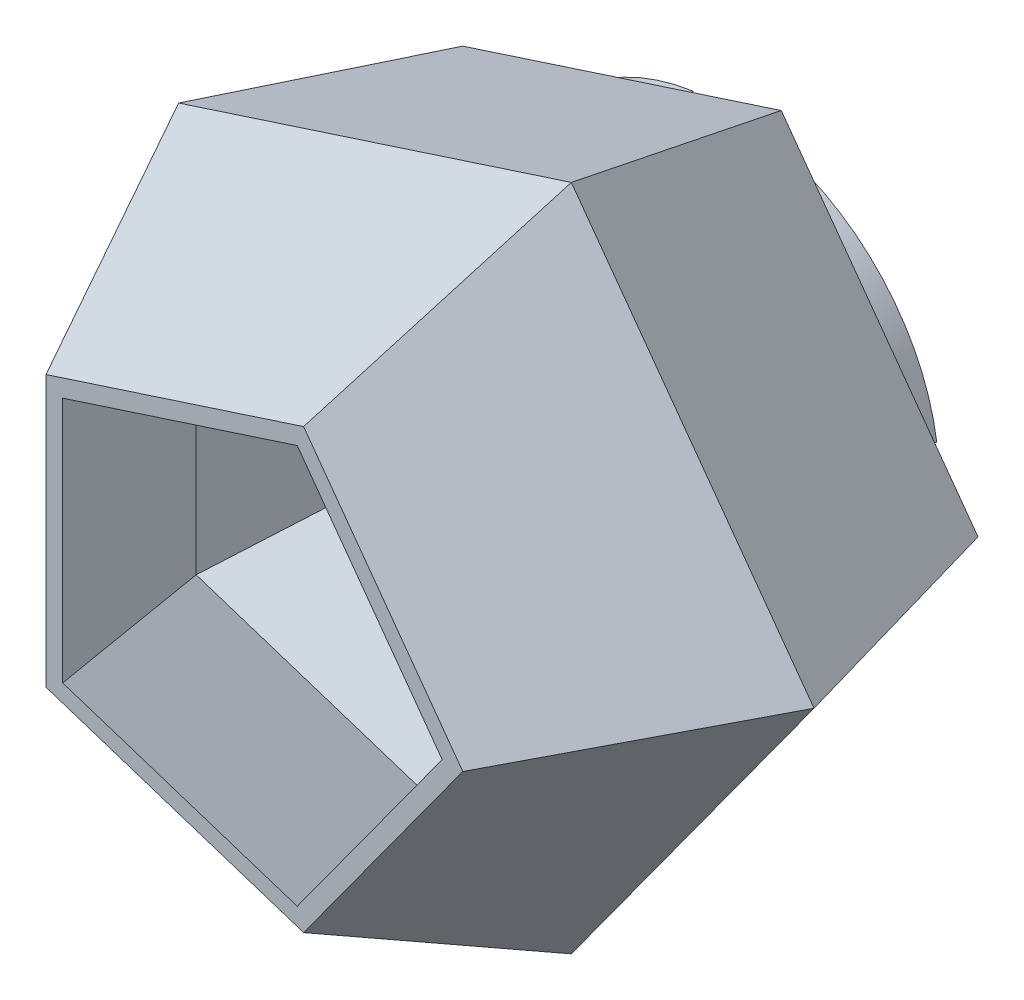
from build123d import *

# Parameters (mm, degrees)
VACIADO1_T              = -1
CROQUIS6_R              = 2.480361355
CORTAR_EXTRUIR1_DEPTH   = 10
SALIENTE_EXTRUIR1_DEPTH = 2


with BuildPart() as part:
    # Croquis2 → Recubrir1 section 0
    with BuildSketch(Plane.XY):
        with BuildLine():
            Line((18.541019662, 0), (5.729490169, 17.633557569))
            Line((5.729490169, 17.633557569), (-15, 10.89813792))
            Line((-15, 10.89813792), (-15, -10.89813792))
            Line((-15, -10.89813792), (5.729490169, -17.633557569))
            Line((5.729490169, -17.633557569), (18.541019662, 0))
        make_face()
    # Croquis3 → Recubrir1 section 1
    with BuildSketch(Plane.XY.offset(15)):
        with BuildLine():
            Line((22.867257584, 0), (7.066371208, 21.748054335))
            Line((7.066371208, 21.748054335), (-18.5, 13.441036768))
            Line((-18.5, 13.441036768), (-18.5, -13.441036768))
            Line((-18.5, -13.441036768), (7.066371208, -21.748054335))
            Line((7.066371208, -21.748054335), (22.867257584, 0))
        make_face()
    loft()

    # Croquis4 → section 1 of recubrir2
    with BuildSketch(Plane.XY.offset(30), mode=Mode.PRIVATE) as recubrir2_s1:
        with BuildLine():
            Line((15, 0), (4.635254916, 14.265847744))
            Line((4.635254916, 14.265847744), (-12.135254916, 8.816778784))
            Line((-12.135254916, 8.816778784), (-12.135254916, -8.816778784))
            Line((-12.135254916, -8.816778784), (4.635254916, -14.265847744))
            Line((4.635254916, -14.265847744), (15, 0))
        make_face()
    # loft from a face of the part (recubrir2)
    loft([part.faces().sort_by_distance((0, 0, 15))[0], recubrir2_s1.sketch])

    # Vaciado1
    vaciado1_openings = [part.faces().sort_by_distance(p)[0] for p in [
        (0, 0, 30),
    ]]
    offset(amount=VACIADO1_T, openings=vaciado1_openings, kind=Kind.INTERSECTION)

    # Croquis6 → Cortar-Extruir1 (cut)
    with BuildSketch(Plane(origin=(0, 0, 0), x_dir=(-1, 0, 0), z_dir=(0, 0, -1))):
        Circle(CROQUIS6_R)
    extrude(amount=-CORTAR_EXTRUIR1_DEPTH, mode=Mode.SUBTRACT)

    # Croquis7 → Saliente-Extruir1 (add)
    with BuildSketch(Plane(origin=(0, 0, 0), x_dir=(-1, 0, 0), z_dir=(0, 0, -1))):
        with BuildLine():
            Line((-2, 13.856406461), (-2, 11.324751653))
            ThreePointArc((-2, 11.324751653), (-8.131727984, 8.131727984), (-11.324751653, 2))
            Line((-11.324751653, 2), (-13.856406461, 2))
            ThreePointArc((-13.856406461, 2), (-9.899494937, 9.899494937), (-2, 13.856406461))
        make_face()
        with BuildLine():
            Line((2, 13.856406461), (2, 11.324751653))
            ThreePointArc((2, 11.324751653), (8.131727984, 8.131727984), (11.324751653, 2))
            Line((11.324751653, 2), (13.856406461, 2))
            ThreePointArc((13.856406461, 2), (9.899494937, 9.899494937), (2, 13.856406461))
        make_face()
        with BuildLine():
            Line((-13.856406461, -2), (-11.324751653, -2))
            ThreePointArc((-11.324751653, -2), (-8.131727984, -8.131727984), (-2, -11.324751653))
            Line((-2, -11.324751653), (-2, -13.856406461))
            ThreePointArc((-2, -13.856406461), (-9.899494937, -9.899494937), (-13.856406461, -2))
        make_face()
        with BuildLine():
            Line((11.324751653, -2), (13.856406461, -2))
            ThreePointArc((13.856406461, -2), (9.899494937, -9.899494937), (2, -13.856406461))
            Line((2, -13.856406461), (2, -11.324751653))
            ThreePointArc((2, -11.324751653), (8.131727984, -8.131727984), (11.324751653, -2))
        make_face()
    extrude(amount=SALIENTE_EXTRUIR1_DEPTH)


solid = part.part
